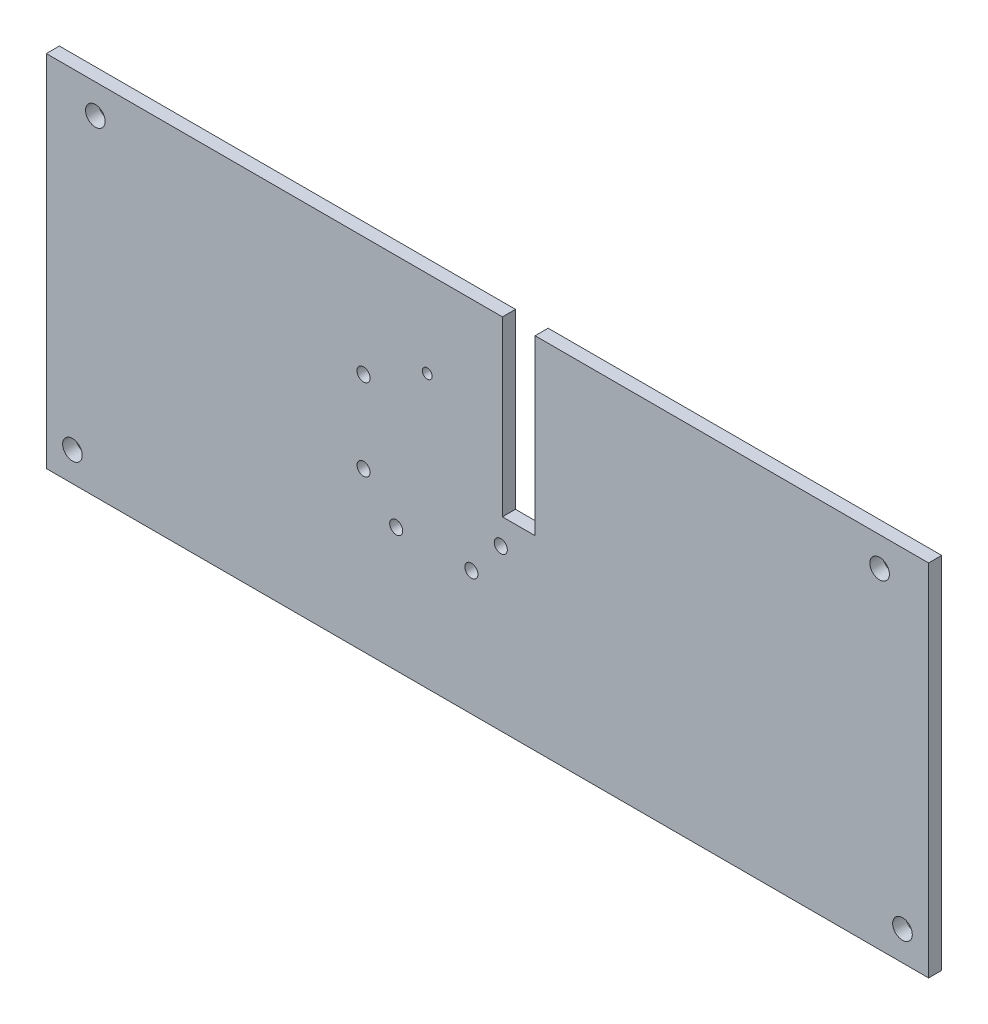
from build123d import *

# Parameters (mm, degrees)
SKETCH1_W           = 270
SKETCH1_H           = 110
BOSS_EXTRUDE1_DEPTH = 4
SKETCH9_R           = 3
SKETCH9_R_2         = 2
SKETCH9_R_3         = 1.5
SKETCH9_W           = 10
SKETCH9_H           = 52.992911327
CUT_EXTRUDE1_DEPTH  = 146.828666592


with BuildPart() as part:
    # Sketch1 → Boss-Extrude1 (new body)
    with BuildSketch(Plane.XY):
        Rectangle(SKETCH1_W, SKETCH1_H)
    extrude(amount=BOSS_EXTRUDE1_DEPTH)

    # Sketch9 → Cut-Extrude1 (cut, through all)
    with BuildSketch(Plane(origin=(0, 0, 0), x_dir=(-1, 0, 0), z_dir=(0, 0, -1))):
        with Locations((-120, 46)):
            Circle(SKETCH9_R)
        with Locations((-127, -46)):
            Circle(SKETCH9_R)
        with Locations((120, 46)):
            Circle(SKETCH9_R)
        with Locations((127, -46)):
            Circle(SKETCH9_R)
        with Locations((-4.074540436, -6)):
            Circle(SKETCH9_R_2)
        with Locations((4.925459564, -17)):
            Circle(SKETCH9_R_2)
        with Locations((27.925459564, -17)):
            Circle(SKETCH9_R_2)
        with Locations((37.925459564, -6.5)):
            Circle(SKETCH9_R_2)
        with Locations((37.925459564, 18.5)):
            Circle(SKETCH9_R_2)
        with Locations((18.425459564, 28.5)):
            Circle(SKETCH9_R_3)
        with Locations((-9.574540436, 28.503544336)):
            Rectangle(SKETCH9_W, SKETCH9_H)
    extrude(amount=-CUT_EXTRUDE1_DEPTH, mode=Mode.SUBTRACT)


solid = part.part
